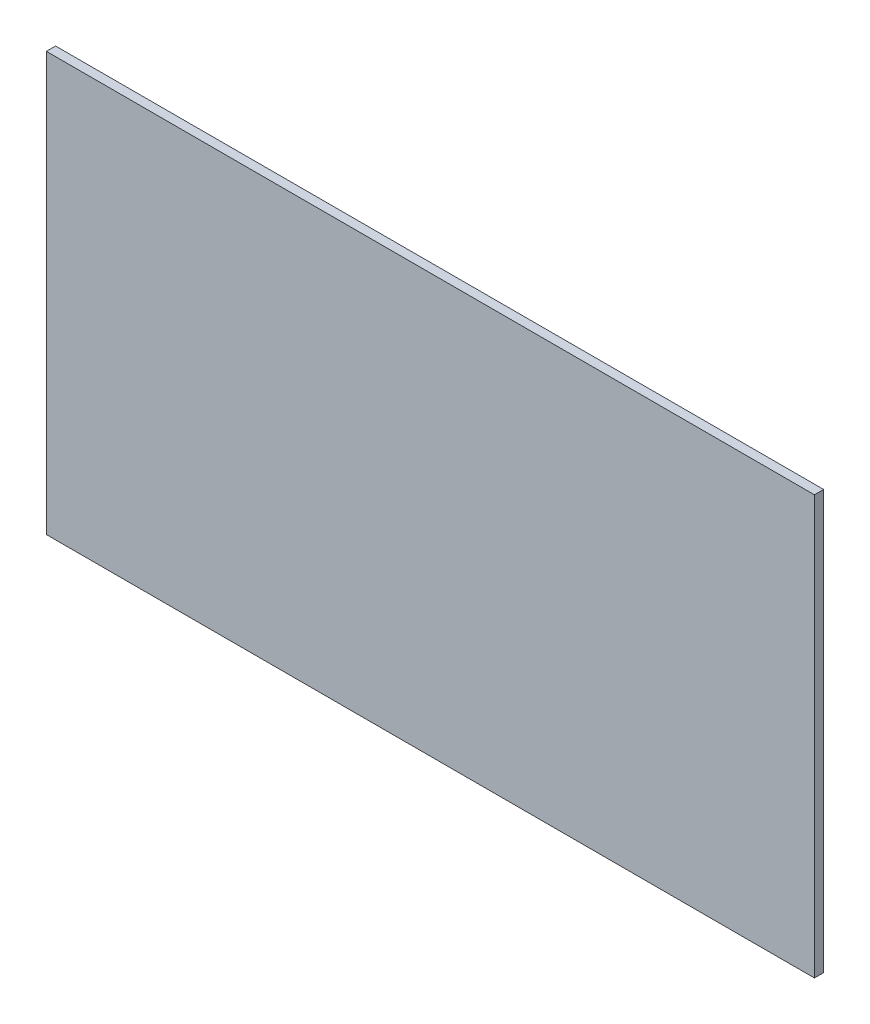
from build123d import *

# Parameters (mm, degrees)
SKETCH1_W           = 140
SKETCH1_H           = 76.28
BOSS_EXTRUDE1_DEPTH = 1.68


with BuildPart() as part:
    # Sketch1 → Boss-Extrude1 (new body)
    with BuildSketch(Plane.XY):
        with Locations((70, 38.14)):
            Rectangle(SKETCH1_W, SKETCH1_H)
    extrude(amount=BOSS_EXTRUDE1_DEPTH)


solid = part.part
